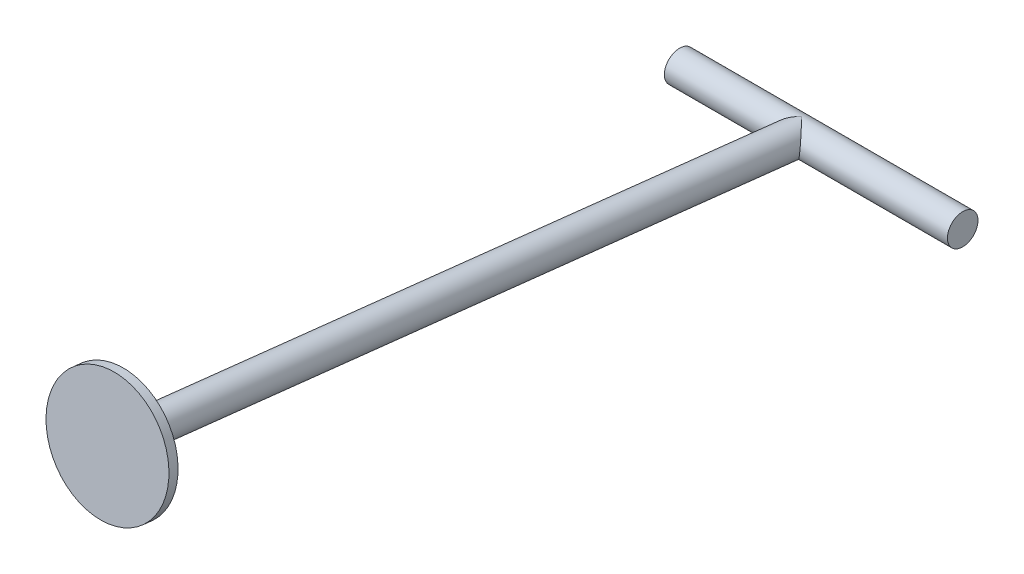
from build123d import *

# Parameters (mm, degrees)
CROQUIS3_R                   = 25
SALIENTE_EXTRUIR1_DEPTH      = 463.3
CROQUIS5_R                   = 100
SALIENTE_EXTRUIR2_DEPTH      = 15
SALIENTE_EXTRUIR3_REACH      = 1699.123
SALIENTE_EXTRUIR3_END_RADIUS = 25
CROQUIS6_R                   = 25


with BuildPart() as part:
    # Croquis3 → Saliente-Extruir1 (new body)
    with BuildSketch(Plane(origin=(-202.746163562, 0, 0), x_dir=(0, 0, -1), z_dir=(1, 0, 0))):
        with Locations((-5751.601025747, 1500.190716107)):
            Circle(CROQUIS3_R)
    extrude(amount=-SALIENTE_EXTRUIR1_DEPTH)



with BuildPart() as body_2:
    # Croquis5 → Saliente-Extruir2 (new body)
    with BuildSketch(Plane(origin=(0, 775.966680828, 6979.147433935), x_dir=(1, 0, 0), z_dir=(0, -0.11050268429861657, -0.9938758256255157))):
        with Locations(Location((-469.396163562, -855.435934207, 0), (0, 0, 90))):
            Circle(CROQUIS5_R)
    extrude(amount=SALIENTE_EXTRUIR2_DEPTH)


with BuildPart() as part_1:
    add(part.part)

    add(body_2.part)  # Saliente-Extruir3 merges body 2
    # Saliente-Extruir3: up to this cylinder (the profile starts outside it)
    saliente_extruir3_end = Plane(origin=(-469.396164, 1500.190716107, 5751.601025747), z_dir=(1, 0, 0)) * Cylinder(SALIENTE_EXTRUIR3_END_RADIUS, 3449.246, mode=Mode.PRIVATE)
    # Croquis6 → Saliente-Extruir3 (add, up to the surface)
    with BuildSketch(Plane(origin=(0, 774.309140563, 6964.239296551), x_dir=(1, 0, 0), z_dir=(0, -0.11050268429861657, -0.9938758256255156)), mode=Mode.PRIVATE) as saliente_extruir3_sk1:
        with Locations(Location((-469.396163562, -855.435934207, 0), (0, 0, 270))):
            Circle(CROQUIS6_R)
    saliente_extruir3_tool1 = extrude(saliente_extruir3_sk1.sketch, amount=SALIENTE_EXTRUIR3_REACH, mode=Mode.PRIVATE) - saliente_extruir3_end
    add(saliente_extruir3_tool1.solids().sort_by_distance((-469.396164, 1624.506236, 6869.71133))[0])


solid = part_1.part
